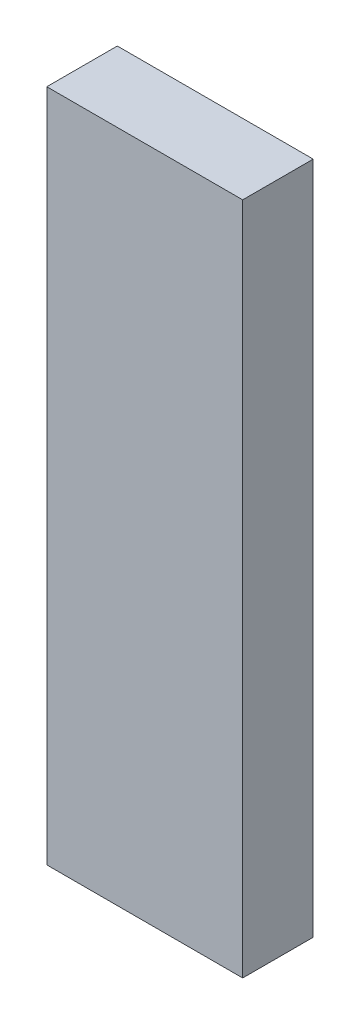
from build123d import *

# Parameters (mm, degrees)
SKETCH1_W           = 50
SKETCH1_H           = 172
BOSS_EXTRUDE1_DEPTH = 18


with BuildPart() as part:
    # Sketch1 → Boss-Extrude1 (new body)
    with BuildSketch(Plane.XY):
        Rectangle(SKETCH1_W, SKETCH1_H)
    extrude(amount=BOSS_EXTRUDE1_DEPTH)


solid = part.part
